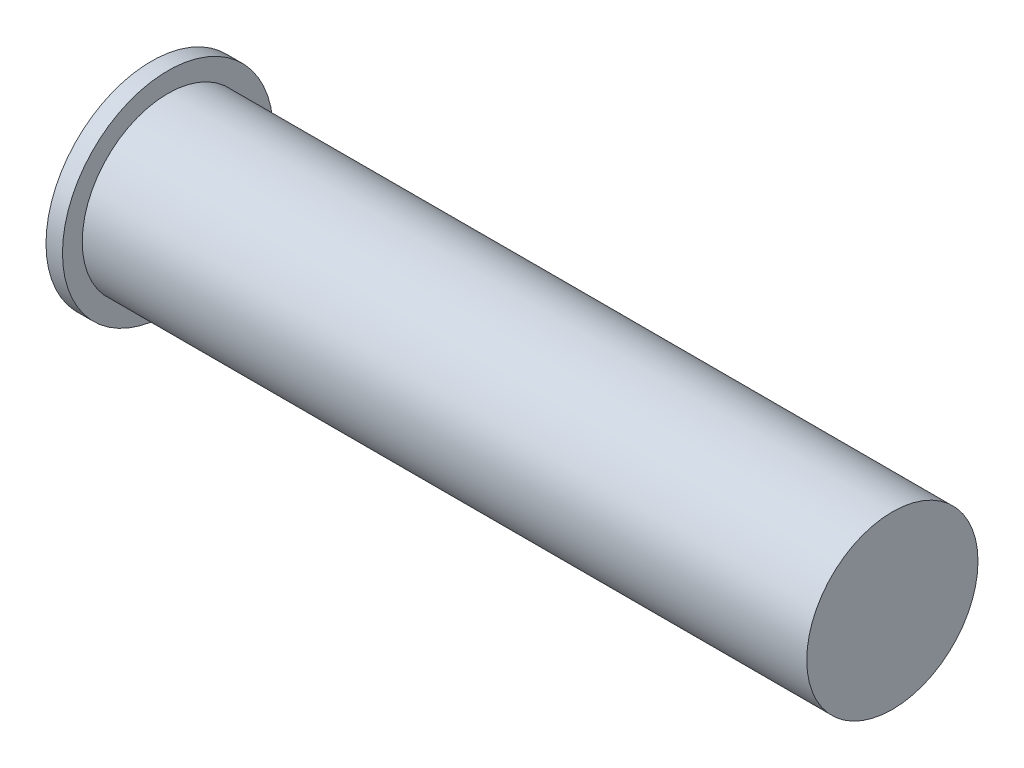
from build123d import *

# Parameters (mm, degrees)
CUT_EXTRUDE1_DEPTH      = 230.505991207
CUT_EXTRUDE1_DEPTH_BACK = 230.505991207
SKETCH2_R               = 10


with BuildPart() as part:
    # Sketch1 → Revolve1 (revolve)
    with BuildSketch(Plane.XY, mode=Mode.PRIVATE) as revolve1_sk:
        Polygon((0, 0), (0, 32), (5, 32), (5, 26), (225, 26), (225, 0), align=None)
    revolve(revolve1_sk.sketch.rotate(Axis((0, 0, 0), (1, 0, 0)), 90), axis=Axis((0, 0, 0), (1, 0, 0)))

    # Sketch2 → Cut-Extrude1 (cut, two sides: drawn at the far end of the back side and taken through both)
    with BuildSketch(Plane(origin=(0, 0, 0), x_dir=(1, 0, 0), z_dir=(0, 1, 0)).offset(-CUT_EXTRUDE1_DEPTH_BACK)):
        with Locations((105, 28)):
            Circle(SKETCH2_R)
    extrude(amount=CUT_EXTRUDE1_DEPTH + CUT_EXTRUDE1_DEPTH_BACK, mode=Mode.SUBTRACT)


solid = part.part
